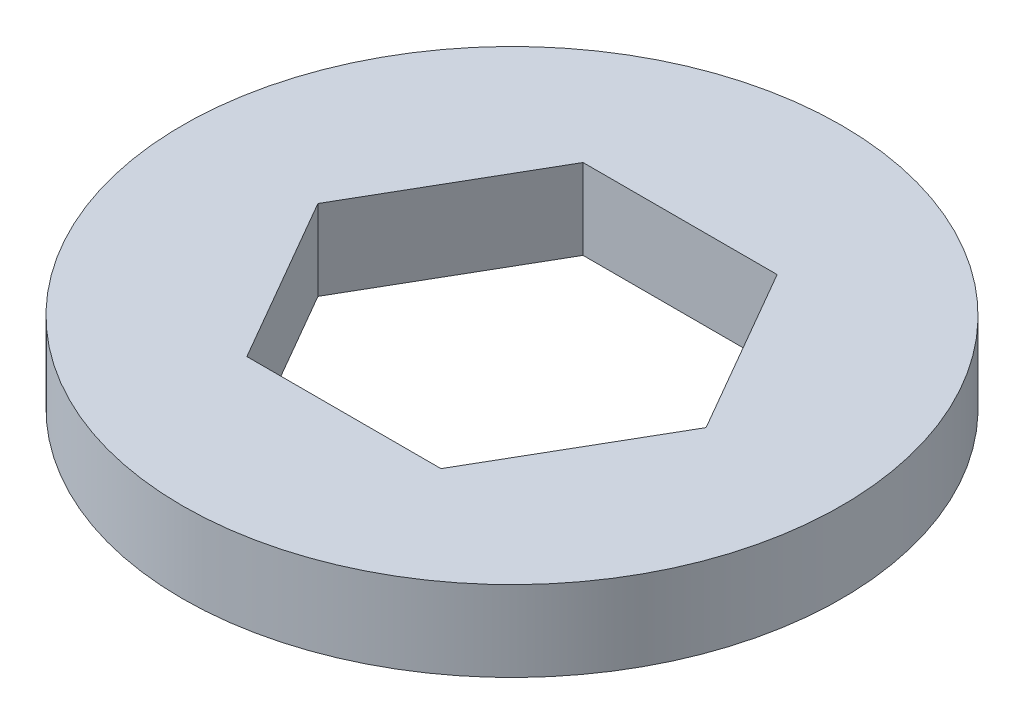
from build123d import *

# Parameters (mm, degrees)
SKETCH1_R           = 12.7
BOSS_EXTRUDE1_DEPTH = 3.1


with BuildPart() as part:
    # Sketch1 → Boss-Extrude1 (new body)
    with BuildSketch(Plane(origin=(0, 0, 0), x_dir=(1, 0, 0), z_dir=(0, 1, 0))):
        with Locations(Location((0, 0, 0), (0, 0, 90))):
            Circle(SKETCH1_R)
        Polygon((7.478995387, 0), (3.739497694, 6.477), (-3.739497694, 6.477), (-7.478995387, 0), (-3.739497694, -6.477), (3.739497694, -6.477), align=None, mode=Mode.SUBTRACT)
    extrude(amount=BOSS_EXTRUDE1_DEPTH)


solid = part.part
